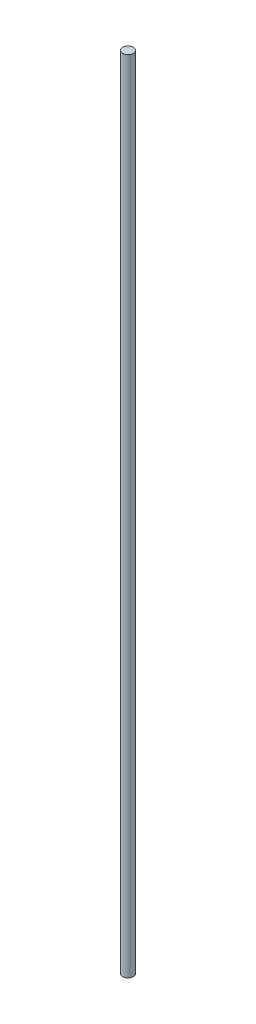
from build123d import *

# Parameters (mm, degrees)
SKETCH2_R           = 0.405
BOSS_EXTRUDE1_DEPTH = 60.8


with BuildPart() as part:
    # Sketch2 → Boss-Extrude1 (new body)
    with BuildSketch(Plane(origin=(0, 0, 0), x_dir=(1, 0, 0), z_dir=(0, 1, 0))):
        with Locations(Location((0, 0, 0), (0, 0, 270))):
            Circle(SKETCH2_R)
    extrude(amount=BOSS_EXTRUDE1_DEPTH)


solid = part.part
